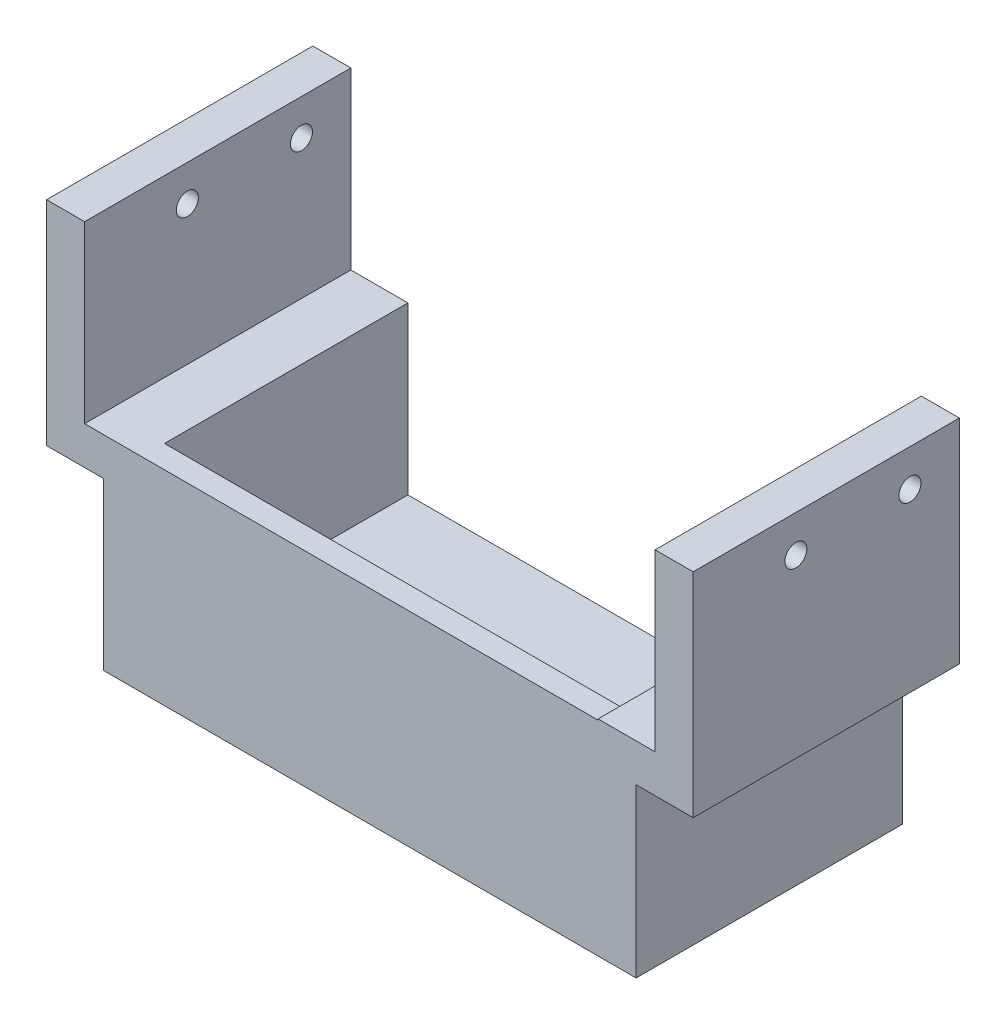
from build123d import *

# Parameters (mm, degrees)
EXTRUDE_1_DEPTH     = 35
EXTRUDE_2_DEPTH     = 3
SKETCH_3_R          = 1.45
CUT_EXTRUDE_1_DEPTH = 98.758571233


with BuildPart() as part:
    # 草圖1 → 填料-伸長1 (new body)
    with BuildSketch(Plane.XY):
        Polygon((-21.293611747, 10.125539125), (-28.793611747, 10.125539125), (-28.793611747, 33.125539125), (-33.793611747, 33.125539125), (-33.793611747, 5.125539125), (-26.293611747, 5.125539125), (-26.293611747, -16.732324255), (43.706388253, -16.732324255), (43.706388253, 5.267675745), (51.206388253, 5.267675745), (51.206388253, 33.267675745), (46.206388253, 33.267675745), (46.206388253, 10.267675745), (38.706388253, 10.267675745), (38.706388253, -11.732324255), (-21.293611747, -11.732324255), align=None)
    extrude(amount=EXTRUDE_1_DEPTH)

    # 草圖2 → 填料-伸長2 (add)
    with BuildSketch(Plane.XY.offset(35)):
        Polygon((51.206388253, 10.125539125), (51.206388253, 5.267675745), (43.706388253, 5.267675745), (43.706388253, -16.732324255), (-26.293611747, -16.732324255), (-26.293611747, 5.125539125), (-33.793611747, 5.125539125), (-33.793611747, 10.125539125), align=None)
    extrude(amount=-EXTRUDE_2_DEPTH)

    # 草圖3 → 除料-伸長1 (cut, through all)
    with BuildSketch(Plane.ZY.offset(33.793611747)):
        with Locations(Location((6.5, 28.407675745, 0), (0, 0, 270))):
            Circle(SKETCH_3_R)
        with Locations(Location((21.5, 28.407675745, 0), (0, 0, 270))):
            Circle(SKETCH_3_R)
    extrude(amount=-CUT_EXTRUDE_1_DEPTH, mode=Mode.SUBTRACT)


solid = part.part
